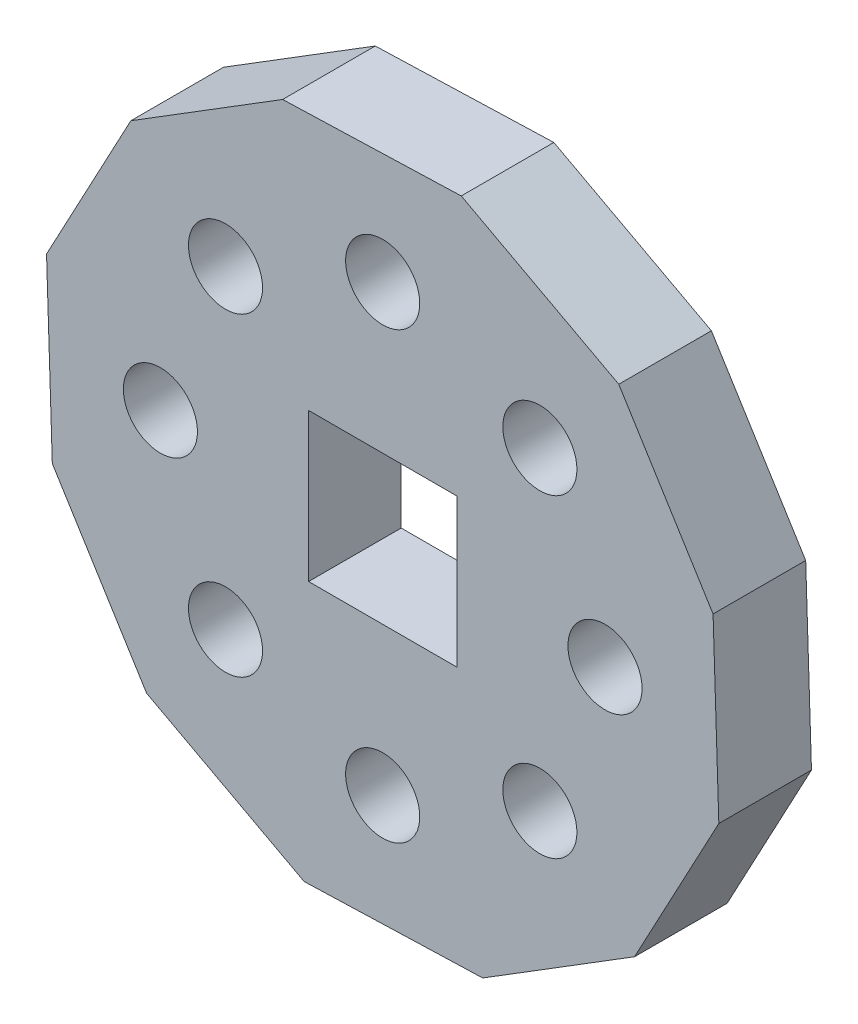
from build123d import *

# Parameters (mm, degrees)
SKETCH3_R           = 10
SKETCH3_W           = 40
SKETCH3_H           = 40
BOSS_EXTRUDE1_DEPTH = 25


with BuildPart() as part:
    # Sketch3 → Boss-Extrude1 (new body)
    with BuildSketch(Plane.XY):
        Polygon((21.199617339, 90.731086511), (-27.006136089, 89.175234501), (-67.975617162, 63.724950422), (-90.731086511, 21.199617339), (-89.175234501, -27.006136089), (-63.724950422, -67.975617162), (-21.199617339, -90.731086511), (27.006136089, -89.175234501), (67.975617162, -63.724950422), (90.731086511, -21.199617339), (89.175234501, 27.006136089), (63.724950422, 67.975617162), align=None)
        with Locations((0, 60)):
            Circle(SKETCH3_R, mode=Mode.SUBTRACT)
        with Locations((42.426406871, 42.426406871)):
            Circle(SKETCH3_R, mode=Mode.SUBTRACT)
        with Locations((60, 0)):
            Circle(SKETCH3_R, mode=Mode.SUBTRACT)
        with Locations((42.426406871, -42.426406871)):
            Circle(SKETCH3_R, mode=Mode.SUBTRACT)
        with Locations((0, -60)):
            Circle(SKETCH3_R, mode=Mode.SUBTRACT)
        with Locations((-42.426406871, -42.426406871)):
            Circle(SKETCH3_R, mode=Mode.SUBTRACT)
        with Locations((-60, 0)):
            Circle(SKETCH3_R, mode=Mode.SUBTRACT)
        with Locations((-42.426406871, 42.426406871)):
            Circle(SKETCH3_R, mode=Mode.SUBTRACT)
        Rectangle(SKETCH3_W, SKETCH3_H, mode=Mode.SUBTRACT)
    extrude(amount=BOSS_EXTRUDE1_DEPTH)


solid = part.part
